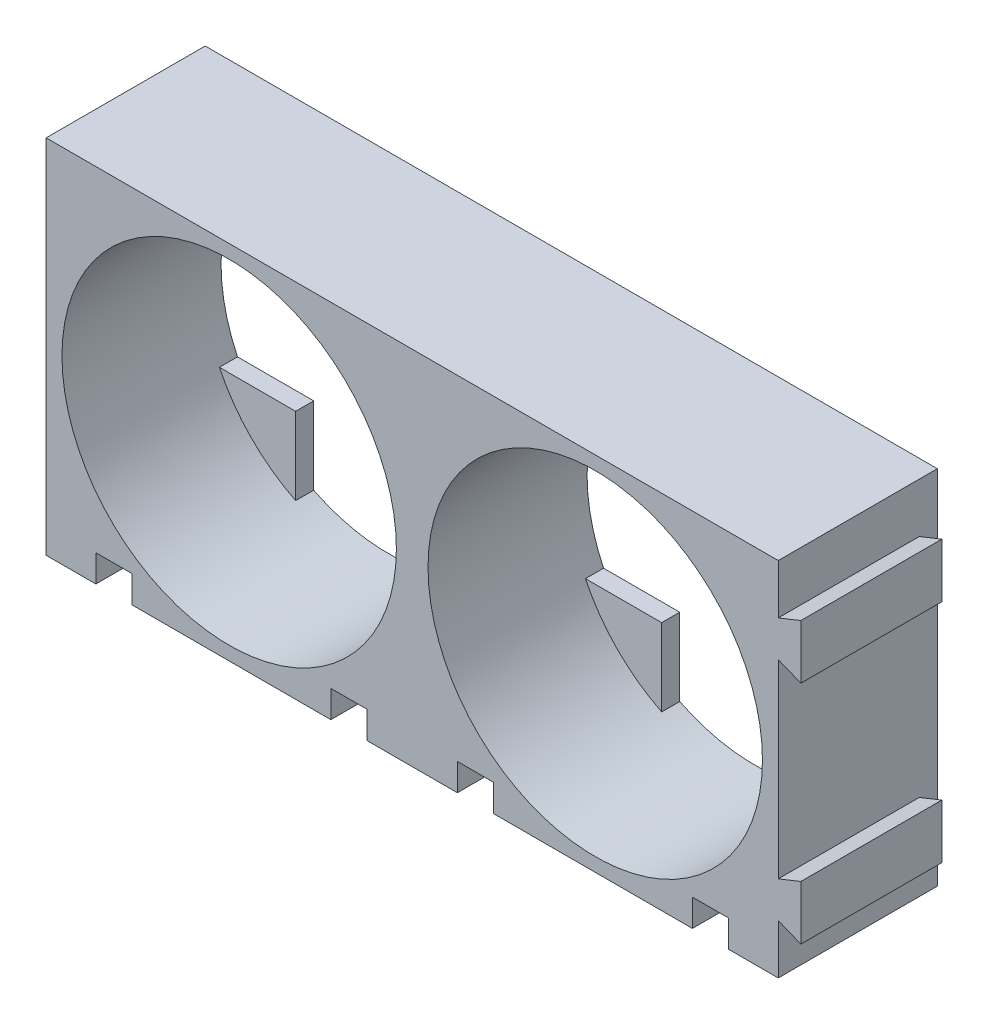
from build123d import *

# Parameters (mm, degrees)
SKETCH1_W           = 40.5
SKETCH1_H           = 20
SKETCH1_R           = 9.25
BOSS_EXTRUDE1_DEPTH = 8.8
SKETCH2_W           = 2
SKETCH2_H           = 7.8
CUT_EXTRUDE1_DEPTH  = 1.5
BOSS_EXTRUDE2_DEPTH = 1


with BuildPart() as part:
    # Sketch1 → Boss-Extrude1 (new body)
    with BuildSketch(Plane.XY):
        Rectangle(SKETCH1_W, SKETCH1_H)
        with Locations((-10.125, 0)):
            Circle(SKETCH1_R, mode=Mode.SUBTRACT)
        with Locations((10.125, 0)):
            Circle(SKETCH1_R, mode=Mode.SUBTRACT)
    extrude(amount=BOSS_EXTRUDE1_DEPTH)

    # Sketch2 → Cut-Extrude1 (cut)
    with BuildSketch(Plane.XZ.offset(10)):
        with Locations((-16.5, 4.9)):
            Rectangle(SKETCH2_W, SKETCH2_H)
        with Locations((-3.5, 4.9)):
            Rectangle(SKETCH2_W, SKETCH2_H)
        with Locations((3.5, 4.9)):
            Rectangle(SKETCH2_W, SKETCH2_H)
        with Locations((16.5, 4.9)):
            Rectangle(SKETCH2_W, SKETCH2_H)
    extrude(amount=-CUT_EXTRUDE1_DEPTH, mode=Mode.SUBTRACT)

    # Sketch3 → Boss-Extrude2 (add)
    with BuildSketch(Plane(origin=(0, 0, 0), x_dir=(-1, 0, 0), z_dir=(0, 0, -1))):
        with BuildLine():
            Line((-6, 4), (-1.784586341, 4))
            ThreePointArc((-1.784586341, 4), (-3.535254547, 6.491360016), (-6, 8.279304017))
            Line((-6, 8.279304017), (-6, 4))
        make_face()
        with BuildLine():
            Line((-14.25, 4), (-14.25, 8.279304017))
            ThreePointArc((-14.25, 8.279304017), (-16.714745453, 6.491360016), (-18.465413659, 4))
            Line((-18.465413659, 4), (-14.25, 4))
        make_face()
        with BuildLine():
            ThreePointArc((-6, -8.279304017), (-3.535254547, -6.491360016), (-1.784586341, -4))
            Line((-1.784586341, -4), (-6, -4))
            Line((-6, -4), (-6, -8.279304017))
        make_face()
        with BuildLine():
            Line((-14.25, -4), (-18.465413659, -4))
            ThreePointArc((-18.465413659, -4), (-16.714745453, -6.491360016), (-14.25, -8.279304017))
            Line((-14.25, -8.279304017), (-14.25, -4))
        make_face()
        with BuildLine():
            Line((1.784586341, 4), (6, 4))
            Line((6, 4), (6, 8.279304017))
            ThreePointArc((6, 8.279304017), (3.535254547, 6.491360016), (1.784586341, 4))
        make_face()
        with BuildLine():
            Line((6, -4), (1.784586341, -4))
            ThreePointArc((1.784586341, -4), (3.535254547, -6.491360016), (6, -8.279304017))
            Line((6, -8.279304017), (6, -4))
        make_face()
        with BuildLine():
            ThreePointArc((18.465413659, 4), (16.714745453, 6.491360016), (14.25, 8.279304017))
            Line((14.25, 8.279304017), (14.25, 4))
            Line((14.25, 4), (18.465413659, 4))
        make_face()
        with BuildLine():
            Line((14.25, -4), (14.25, -8.279304017))
            ThreePointArc((14.25, -8.279304017), (16.714745453, -6.491360016), (18.465413659, -4))
            Line((18.465413659, -4), (14.25, -4))
        make_face()
    extrude(amount=-BOSS_EXTRUDE2_DEPTH)

    # Sketch4 → Loft1 section 0
    with BuildSketch(Plane(origin=(20.25, 0, 0), x_dir=(0, 0, -1), z_dir=(1, 0, 0))):
        with BuildLine():
            Line((-8.8, 7.25), (-1, 7.25))
            Line((-1, 7.25), (-1, 5.25))
            Line((-1, 5.25), (-8.8, 5.25))
            Line((-8.8, 5.25), (-8.8, 7.25))
        make_face()
    # Sketch5 → Loft1 section 1
    with BuildSketch(Plane(origin=(21.5, 0, 0), x_dir=(0, 0, -1), z_dir=(1, 0, 0))):
        with BuildLine():
            Line((-8.8, 7.75), (-1, 7.75))
            Line((-1, 7.75), (-1, 4.75))
            Line((-1, 4.75), (-8.8, 4.75))
            Line((-8.8, 4.75), (-8.8, 7.75))
        make_face()
    loft()

    # Sketch4<3> → Loft2 section 0
    with BuildSketch(Plane(origin=(20.25, 0, 0), x_dir=(0, 0, -1), z_dir=(1, 0, 0))):
        with BuildLine():
            Line((-8.8, -5.25), (-1, -5.25))
            Line((-1, -5.25), (-1, -7.25))
            Line((-1, -7.25), (-8.8, -7.25))
            Line((-8.8, -7.25), (-8.8, -5.25))
        make_face()
    # Sketch5<3> → Loft2 section 1
    with BuildSketch(Plane(origin=(21.5, 0, 0), x_dir=(0, 0, -1), z_dir=(1, 0, 0))):
        with BuildLine():
            Line((-8.8, -4.75), (-1, -4.75))
            Line((-1, -4.75), (-1, -7.75))
            Line((-1, -7.75), (-8.8, -7.75))
            Line((-8.8, -7.75), (-8.8, -4.75))
        make_face()
    loft()


solid = part.part
